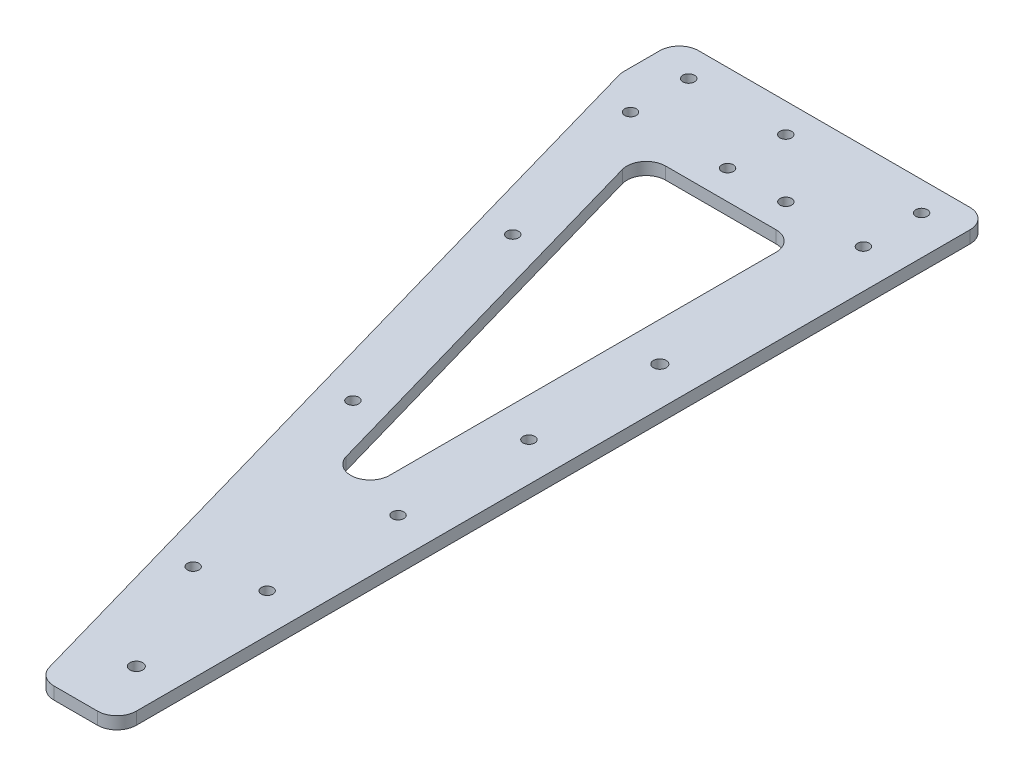
from build123d import *

# Parameters (mm, degrees)
SKETCH1_R           = 1.5
SKETCH1_R_2         = 1.65
BOSS_EXTRUDE1_DEPTH = 3.175
SKETCH2_W           = 80
SKETCH2_H           = 15
SKETCH2_R           = 1.5
BOSS_EXTRUDE2_DEPTH = 3.175
FILLET1_R           = 5


with BuildPart() as part:
    # Sketch1 → Boss-Extrude1 (new body)
    with BuildSketch(Plane(origin=(0, 0, 0), x_dir=(1, 0, 0), z_dir=(0, 1, 0))):
        Polygon((-20, -210), (0, -210), (0, 0), (-80, 0), align=None)
        with Locations(Location((-41.422797756, -107.71979577, 0), (0, 0, 270))):
            Circle(SKETCH1_R, mode=Mode.SUBTRACT)
        with Locations(Location((-24.939530082, -165.411232629, 0), (0, 0, 270))):
            Circle(SKETCH1_R, mode=Mode.SUBTRACT)
        with Locations(Location((-10, -195, 0), (0, 0, 270))):
            Circle(SKETCH1_R_2, mode=Mode.SUBTRACT)
        with BuildLine():
            ThreePointArc((-10, -159.75), (-8.5, -161.25), (-10, -162.75))
            ThreePointArc((-10, -162.75), (-11.5, -161.25), (-10, -159.75))
        make_face(mode=Mode.SUBTRACT)
        with BuildLine():
            ThreePointArc((-10, -126), (-8.5, -127.5), (-10, -129))
            ThreePointArc((-10, -129), (-11.5, -127.5), (-10, -126))
        make_face(mode=Mode.SUBTRACT)
        Polygon((-20, -15), (-20, -155.39917583), (-60.114050237, -15), align=None, mode=Mode.SUBTRACT)
        with Locations(Location((-57.90606543, -50.028358912, 0), (0, 0, 270))):
            Circle(SKETCH1_R, mode=Mode.SUBTRACT)
        with Locations(Location((-70.057025119, -7.5, 0), (0, 0, 270))):
            Circle(SKETCH1_R, mode=Mode.SUBTRACT)
        with Locations(Location((-45.028512559, -7.5, 0), (0, 0, 270))):
            Circle(SKETCH1_R, mode=Mode.SUBTRACT)
        with BuildLine():
            ThreePointArc((-10, -92.25), (-8.5, -93.75), (-10, -95.25))
            ThreePointArc((-10, -95.25), (-11.5, -93.75), (-10, -92.25))
        make_face(mode=Mode.SUBTRACT)
        with Locations(Location((-10, -60, 0), (0, 0, 270))):
            Circle(SKETCH1_R_2, mode=Mode.SUBTRACT)
        with Locations(Location((-30, -7.5, 0), (0, 0, 270))):
            Circle(SKETCH1_R, mode=Mode.SUBTRACT)
        with Locations(Location((-10, -7.5, 0), (0, 0, 270))):
            Circle(SKETCH1_R, mode=Mode.SUBTRACT)
    extrude(amount=BOSS_EXTRUDE1_DEPTH)

    # Sketch2 → Boss-Extrude2 (add)
    with BuildSketch(Plane.XZ):
        with Locations((-40, -7.5)):
            Rectangle(SKETCH2_W, SKETCH2_H)
        with Locations(Location((-70.057025119, -7.5, 0), (0, 0, 270))):
            Circle(SKETCH2_R, mode=Mode.SUBTRACT)
        with Locations(Location((-45.028512559, -7.5, 0), (0, 0, 270))):
            Circle(SKETCH2_R, mode=Mode.SUBTRACT)
        with Locations(Location((-10, -7.5, 0), (0, 0, 270))):
            Circle(SKETCH2_R, mode=Mode.SUBTRACT)
    extrude(amount=-BOSS_EXTRUDE2_DEPTH)

    # Fillet1
    fillet1_edges = [part.edges().sort_by_distance(p)[0] for p in [
        (-80, 1.5875, 0),
        (0, 1.5875, 210),
        (-20, 1.5875, 210),
        (-20, 1.5875, 15),
        (-60.114050237, 1.5875, 15),
        (-20, 1.5875, 155.39917583),
        (0, 1.5875, -15),
        (-80, 1.5875, -15),
    ]]
    fillet(fillet1_edges, radius=FILLET1_R)


solid = part.part
